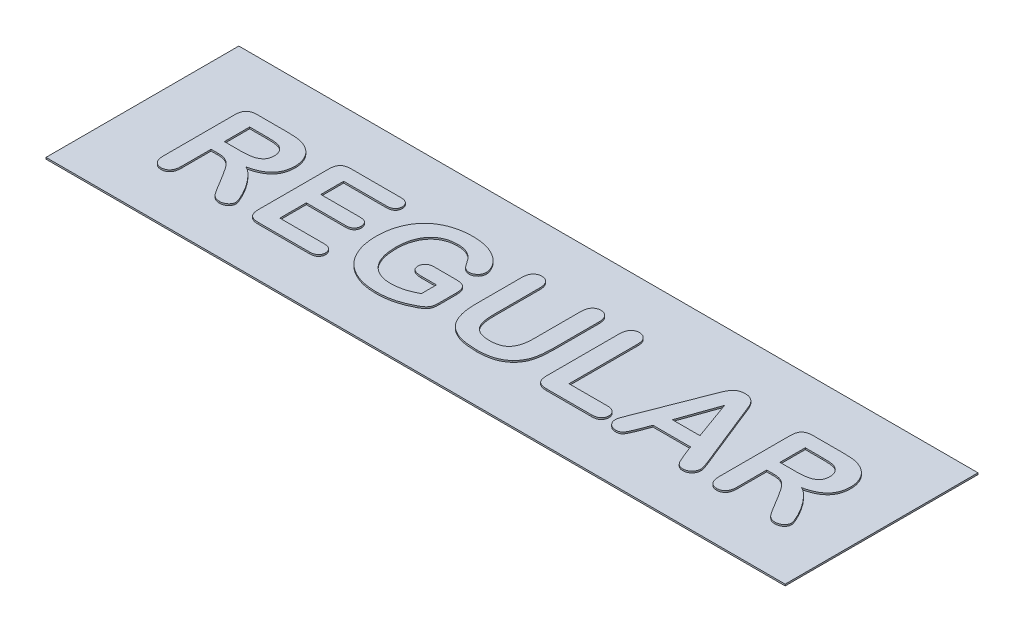
from build123d import *

# Parameters (mm, degrees)
SKETCH1_W             = 46
SKETCH1_H             = 12
BOSS_EXTRUDE2_DEPTH   = 0.1
BOSS_EXTRUDE3_DEPTH   = 0.1
BOSS_EXTRUDE3_2_DEPTH = 0.1
BOSS_EXTRUDE3_3_DEPTH = 0.1
BOSS_EXTRUDE3_4_DEPTH = 0.1
BOSS_EXTRUDE3_5_DEPTH = 0.1
BOSS_EXTRUDE3_6_DEPTH = 0.1
BOSS_EXTRUDE3_7_DEPTH = 0.1


with BuildPart() as part:
    # Sketch1 → Boss-Extrude2 (new body)
    with BuildSketch(Plane(origin=(0, 0, 0), x_dir=(1, 0, 0), z_dir=(0, 1, 0))):
        with Locations((23, 6)):
            Rectangle(SKETCH1_W, SKETCH1_H)
    extrude(amount=-BOSS_EXTRUDE2_DEPTH)


with BuildPart() as body_2:
    # Sketch1<8> → Boss-Extrude3 (new body)
    with BuildSketch(Plane(origin=(0, 0, 0), x_dir=(1, 0, 0), z_dir=(0, 1, 0))):
        with BuildLine():
            Line((4.8, 5.475), (5.20546875, 5.475))
            add(Edge.make_bspline(
                [(6.563671875, 4.4390625), (6.488132931, 4.566049267), (6.379223288, 4.745201379), (6.223959731, 4.957496355), (6.121450414, 5.083819877), (6.02183197, 5.189189861), (5.922440935, 5.275941057), (5.820671752, 5.343078456), (5.717195866, 5.395807363), (5.606013188, 5.432238927), (5.435933712, 5.467970275), (5.299802011, 5.475098601), (5.20546875, 5.475)],
                knots=[0, 0, 0, 0, 0.244142452, 0.345681055, 0.434138568, 0.512613133, 0.584888302, 0.651441801, 0.713464622, 0.776088324, 0.844027858, 1, 1, 1, 1], degree=3))
            Line((6.563671875, 4.4390625), (7.034765625, 3.664453125))
            add(Edge.make_bspline(
                [(7.862109375, 2.925), (7.80077763, 2.924303966), (7.711462553, 2.936055619), (7.6004913, 2.973770215), (7.504731777, 3.028498948), (7.399159332, 3.118185771), (7.309699419, 3.228758574), (7.240720525, 3.333287728), (7.153820201, 3.471973163), (7.082360746, 3.583123174), (7.034765625, 3.664453125)],
                knots=[0, 0, 0, 0, 0.156735873, 0.228882219, 0.298751946, 0.437996262, 0.580828227, 0.661577114, 0.758722562, 1, 1, 1, 1], degree=3))
            add(Edge.make_bspline(
                [(8.428125, 3.390234375), (8.427688268, 3.309405344), (8.390362325, 3.210448226), (8.315575572, 3.111859141), (8.269407939, 3.063725619), (8.215039743, 3.023316341), (8.155179151, 2.9877855), (8.089451505, 2.959584965), (7.991988148, 2.932715505), (7.91497017, 2.923551785), (7.862109375, 2.925)],
                knots=[0, 0, 0, 0, 0.295220797, 0.376756448, 0.457519475, 0.541080536, 0.626619062, 0.714697518, 0.804851451, 1, 1, 1, 1], degree=3))
            add(Edge.make_bspline(
                [(6.840234375, 5.6109375), (6.949950405, 5.555117365), (7.106398278, 5.447812043), (7.300898579, 5.276897241), (7.44272375, 5.125475185), (7.580450643, 4.96389644), (7.713491615, 4.796465363), (7.837563874, 4.623011222), (7.951915159, 4.446222298), (8.057695077, 4.272465909), (8.151831942, 4.104935819), (8.23251678, 3.945508196), (8.301138243, 3.797455583), (8.35561695, 3.665287643), (8.402246218, 3.532712789), (8.425659253, 3.443246141), (8.428125, 3.390234375)],
                knots=[0, 0, 0, 0, 0.131918797, 0.202970264, 0.277760532, 0.354539483, 0.43101514, 0.507400958, 0.583515463, 0.657132417, 0.725886823, 0.789877002, 0.849016927, 0.901145487, 0.943344078, 1, 1, 1, 1], degree=3))
            add(Edge.make_bspline(
                [(8.325, 7.187109375), (8.325355895, 7.08475474), (8.313948751, 6.934506471), (8.275776273, 6.741460278), (8.236790465, 6.607451357), (8.182762332, 6.482536912), (8.120094895, 6.365099851), (8.045217076, 6.255719388), (7.958282005, 6.154807007), (7.858988233, 6.062219311), (7.748880557, 5.975897337), (7.627204263, 5.896226823), (7.492679261, 5.825047399), (7.346699794, 5.760199145), (7.129756286, 5.682932639), (6.959099235, 5.634595403), (6.840234375, 5.6109375)],
                knots=[0, 0, 0, 0, 0.128838583, 0.189022761, 0.247527807, 0.304161196, 0.36005304, 0.414889875, 0.470686436, 0.527396645, 0.585540917, 0.646650323, 0.710236628, 0.776948807, 0.847579249, 1, 1, 1, 1], degree=3))
            add(Edge.make_bspline(
                [(7.40859375, 8.6015625), (7.499085111, 8.563901578), (7.629602741, 8.494443625), (7.787684196, 8.377360482), (7.896578878, 8.277053213), (7.996672685, 8.16800573), (8.0819868, 8.047080907), (8.156484974, 7.919163212), (8.2173836, 7.782717198), (8.264787242, 7.640082538), (8.313399382, 7.442691358), (8.323706597, 7.289360773), (8.325, 7.187109375)],
                knots=[0, 0, 0, 0, 0.164225545, 0.246593832, 0.329086935, 0.412064511, 0.494190426, 0.576621145, 0.659854065, 0.744123517, 0.828291164, 1, 1, 1, 1], degree=3))
            add(Edge.make_bspline(
                [(6.25078125, 8.775), (6.370285572, 8.773587483), (6.543309163, 8.773082212), (6.763880029, 8.75614966), (6.910171704, 8.741246399), (7.046021318, 8.721203113), (7.21348561, 8.680119583), (7.333459015, 8.638125672), (7.40859375, 8.6015625)],
                knots=[0, 0, 0, 0, 0.30393904, 0.439344554, 0.562157432, 0.67773677, 0.788038966, 1, 1, 1, 1], degree=3))
            Line((6.25078125, 8.775), (4.38046875, 8.775))
            add(Edge.make_bspline(
                [(3.675, 8.061328125), (3.675308005, 8.170279478), (3.689199915, 8.326180519), (3.762022187, 8.508006939), (3.837127021, 8.61036927), (3.938266296, 8.68673292), (4.117849906, 8.761504861), (4.272818959, 8.774435976), (4.38046875, 8.775)],
                knots=[0, 0, 0, 0, 0.28251968, 0.39735437, 0.501853918, 0.606158559, 0.720460412, 1, 1, 1, 1], degree=3))
            Line((3.675, 8.061328125), (3.675, 3.63515625))
            add(Edge.make_bspline(
                [(4.23984375, 2.925), (4.158886662, 2.925589465), (4.037699026, 2.94378944), (3.901470704, 3.023932799), (3.817615614, 3.103967843), (3.752582037, 3.207513798), (3.688883057, 3.384039244), (3.67482532, 3.532042676), (3.675, 3.63515625)],
                knots=[0, 0, 0, 0, 0.23764918, 0.345820654, 0.45613364, 0.572351178, 0.698802028, 1, 1, 1, 1], degree=3))
            add(Edge.make_bspline(
                [(4.8, 3.6328125), (4.799883814, 3.527204631), (4.787898379, 3.375043947), (4.718177394, 3.197022183), (4.649341031, 3.096050324), (4.563994624, 3.019648051), (4.431937759, 2.94415627), (4.316812386, 2.924338285), (4.23984375, 2.925)],
                knots=[0, 0, 0, 0, 0.31150778, 0.440094073, 0.55712165, 0.666707926, 0.773500033, 1, 1, 1, 1], degree=3))
            Line((4.8, 3.6328125), (4.8, 5.475))
        make_face()
        with BuildLine():
            Line((4.8, 7.875), (5.86875, 7.875))
            add(Edge.make_bspline(
                [(6.669140625, 7.789453125), (6.628150302, 7.805576607), (6.558954544, 7.825809941), (6.456802901, 7.841739161), (6.363193382, 7.855318454), (6.257168718, 7.864345061), (6.09108398, 7.871401594), (5.960224258, 7.87634057), (5.86875, 7.875)],
                knots=[0, 0, 0, 0, 0.163377821, 0.266296542, 0.383317579, 0.51425336, 0.660794558, 1, 1, 1, 1], degree=3))
            add(Edge.make_bspline(
                [(7.125, 7.096875), (7.126439489, 7.172908836), (7.110825528, 7.284837504), (7.059457829, 7.424166375), (7.006534694, 7.518721496), (6.941003814, 7.60521102), (6.833620245, 7.705002836), (6.73813641, 7.761939914), (6.669140625, 7.789453125)],
                knots=[0, 0, 0, 0, 0.258249544, 0.38020611, 0.503358993, 0.625641018, 0.747872473, 1, 1, 1, 1], degree=3))
            add(Edge.make_bspline(
                [(5.837109375, 6.3), (5.965703401, 6.301076317), (6.150653996, 6.306319733), (6.384966129, 6.337230903), (6.536075341, 6.368125316), (6.672019222, 6.409070051), (6.789539875, 6.466294173), (6.892994353, 6.532518553), (6.977630186, 6.615058013), (7.04561401, 6.712244152), (7.110058, 6.871834148), (7.125233852, 7.005274554), (7.125, 7.096875)],
                knots=[0, 0, 0, 0, 0.223419646, 0.320582623, 0.409966491, 0.491044997, 0.566273496, 0.636246749, 0.703392198, 0.770177044, 0.840710079, 1, 1, 1, 1], degree=3))
            Line((5.837109375, 6.3), (4.8, 6.3))
            Line((4.8, 6.3), (4.8, 7.875))
        make_face(mode=Mode.SUBTRACT)
    extrude(amount=BOSS_EXTRUDE3_DEPTH)


with BuildPart() as body_3:
    # Sketch1<8> → Boss-Extrude3 2 (new body)
    with BuildSketch(Plane(origin=(0, 0, 0), x_dir=(1, 0, 0), z_dir=(0, 1, 0))):
        with BuildLine():
            Line((10.65, 7.875), (13.29609375, 7.875))
            add(Edge.make_bspline(
                [(13.850390625, 8.32734375), (13.850773588, 8.264579899), (13.836245453, 8.170288747), (13.775431727, 8.062738343), (13.714599634, 7.994241991), (13.635241465, 7.939564218), (13.496630735, 7.884342893), (13.37787849, 7.877145344), (13.29609375, 7.875)],
                knots=[0, 0, 0, 0, 0.23312118, 0.342370478, 0.452806013, 0.56896429, 0.695252156, 1, 1, 1, 1], degree=3))
            add(Edge.make_bspline(
                [(13.29609375, 8.775), (13.377594366, 8.772195575), (13.497255442, 8.766744358), (13.634953597, 8.709003244), (13.714721459, 8.654717988), (13.774660484, 8.586402875), (13.836770414, 8.481797204), (13.850296333, 8.38873056), (13.850390625, 8.32734375)],
                knots=[0, 0, 0, 0, 0.306655187, 0.434288731, 0.551174014, 0.662300739, 0.7697085, 1, 1, 1, 1], degree=3))
            Line((13.29609375, 8.775), (10.2140625, 8.775))
            add(Edge.make_bspline(
                [(9.525, 8.0578125), (9.525693912, 8.13416374), (9.531528207, 8.244299349), (9.561998454, 8.381448349), (9.593834136, 8.468198914), (9.634501115, 8.54455926), (9.687234981, 8.609185452), (9.750259263, 8.662305605), (9.823049373, 8.705404862), (9.906657417, 8.736215072), (10.036415053, 8.769710059), (10.141820693, 8.773446574), (10.2140625, 8.775)],
                knots=[0, 0, 0, 0, 0.198923952, 0.285459035, 0.364561105, 0.438695517, 0.509487423, 0.580147896, 0.652133435, 0.728383258, 0.811204159, 1, 1, 1, 1], degree=3))
            Line((9.525, 8.0578125), (9.525, 3.7171875))
            add(Edge.make_bspline(
                [(10.2140625, 3), (10.108332644, 3.000296848), (9.955970111, 3.013587041), (9.779965317, 3.088314308), (9.680603595, 3.164855755), (9.608783114, 3.268838684), (9.536863079, 3.451213022), (9.527305314, 3.608411538), (9.525, 3.7171875)],
                knots=[0, 0, 0, 0, 0.276680916, 0.389999231, 0.493501638, 0.598426673, 0.714696995, 1, 1, 1, 1], degree=3))
            Line((10.2140625, 3), (13.3875, 3))
            add(Edge.make_bspline(
                [(13.9453125, 3.446484375), (13.947522376, 3.384865313), (13.928630468, 3.294255844), (13.869072123, 3.187884105), (13.805811083, 3.120816037), (13.72552466, 3.065558889), (13.586414383, 3.011751537), (13.469028069, 3.000371927), (13.3875, 3)],
                knots=[0, 0, 0, 0, 0.227881193, 0.33651993, 0.449574496, 0.567622836, 0.696013188, 1, 1, 1, 1], degree=3))
            add(Edge.make_bspline(
                [(13.3875, 3.9), (13.468426618, 3.897686895), (13.587164331, 3.890913627), (13.72525912, 3.834126283), (13.805820022, 3.779263489), (13.869397865, 3.711911944), (13.929300088, 3.603061758), (13.946973989, 3.509829457), (13.9453125, 3.446484375)],
                knots=[0, 0, 0, 0, 0.301114702, 0.428957738, 0.546002067, 0.658095095, 0.76706378, 1, 1, 1, 1], degree=3))
            Line((13.3875, 3.9), (10.65, 3.9))
            Line((10.65, 3.9), (10.65, 5.55))
            Line((10.65, 5.55), (13.086328125, 5.55))
            add(Edge.make_bspline(
                [(13.620703125, 6.003515625), (13.621232245, 5.94179952), (13.606167392, 5.849795065), (13.549204022, 5.742392505), (13.491126944, 5.673292262), (13.415319924, 5.616891989), (13.281488685, 5.560003506), (13.165941204, 5.551352304), (13.086328125, 5.55)],
                knots=[0, 0, 0, 0, 0.23345114, 0.343651819, 0.45565437, 0.571599419, 0.697114971, 1, 1, 1, 1], degree=3))
            add(Edge.make_bspline(
                [(13.086328125, 6.45), (13.165001897, 6.447975159), (13.279659965, 6.440553228), (13.413004241, 6.38514946), (13.489440245, 6.330747911), (13.548090685, 6.263077606), (13.607305409, 6.157619891), (13.620623224, 6.064934483), (13.620703125, 6.003515625)],
                knots=[0, 0, 0, 0, 0.301571246, 0.427298253, 0.544300415, 0.654763056, 0.765065983, 1, 1, 1, 1], degree=3))
            Line((13.086328125, 6.45), (10.65, 6.45))
            Line((10.65, 6.45), (10.65, 7.875))
        make_face()
    extrude(amount=BOSS_EXTRUDE3_2_DEPTH)


with BuildPart() as body_4:
    # Sketch1<8> → Boss-Extrude3 3 (new body)
    with BuildSketch(Plane(origin=(0, 0, 0), x_dir=(1, 0, 0), z_dir=(0, 1, 0))):
        with BuildLine():
            Line((20.175, 4.26328125), (20.175, 5.373046875))
            add(Edge.make_bspline(
                [(19.3828125, 6.075), (19.45826278, 6.075128587), (19.567134847, 6.071495909), (19.704917092, 6.051932486), (19.795260748, 6.032774344), (19.877823346, 6.003888033), (19.952073724, 5.960968065), (20.01733925, 5.903395612), (20.074384752, 5.832098879), (20.121353534, 5.744035872), (20.167023522, 5.590647375), (20.173201238, 5.462673428), (20.175, 5.373046875)],
                knots=[0, 0, 0, 0, 0.182635189, 0.262813499, 0.336401339, 0.405747724, 0.473491938, 0.542470401, 0.615074948, 0.693280203, 0.782342712, 1, 1, 1, 1], degree=3))
            Line((19.3828125, 6.075), (18.055078125, 6.075))
            add(Edge.make_bspline(
                [(17.534765625, 5.619140625), (17.532843062, 5.681018627), (17.551390921, 5.772594156), (17.611303754, 5.879762582), (17.672587635, 5.949164247), (17.749706598, 6.005676941), (17.875141934, 6.063691467), (17.982822418, 6.073599632), (18.055078125, 6.075)],
                knots=[0, 0, 0, 0, 0.238017011, 0.352115555, 0.470709416, 0.592556655, 0.718731389, 1, 1, 1, 1], degree=3))
            add(Edge.make_bspline(
                [(18.20625, 5.175), (18.108684038, 5.172744535), (17.971281838, 5.185565873), (17.803336897, 5.226248418), (17.705342096, 5.270464603), (17.628124184, 5.332064251), (17.549001424, 5.442632433), (17.535465292, 5.549358696), (17.534765625, 5.619140625)],
                knots=[0, 0, 0, 0, 0.318178419, 0.448792747, 0.562963014, 0.666395041, 0.768008497, 1, 1, 1, 1], degree=3))
            Line((18.20625, 5.175), (19.125, 5.175))
            Line((19.125, 5.175), (19.125, 4.23515625))
            add(Edge.make_bspline(
                [(17.619140625, 3.825), (17.75236847, 3.825157659), (17.949771281, 3.838341645), (18.207089618, 3.881877302), (18.392264591, 3.92994215), (18.575206997, 3.989127423), (18.822690567, 4.084437619), (19.004414503, 4.172005975), (19.125, 4.23515625)],
                knots=[0, 0, 0, 0, 0.253330495, 0.375477271, 0.495850923, 0.616855766, 0.741037341, 1, 1, 1, 1], degree=3))
            add(Edge.make_bspline(
                [(15.825, 5.954296875), (15.824872026, 5.79305804), (15.836851966, 5.557173672), (15.88835108, 5.255723802), (15.939344045, 5.050396252), (16.006513076, 4.859926164), (16.086875941, 4.683070334), (16.183397939, 4.521378995), (16.294964676, 4.375735254), (16.419799366, 4.246237401), (16.556214945, 4.13283916), (16.704971986, 4.037208132), (16.865776823, 3.959753483), (17.037399697, 3.898632962), (17.287976765, 3.839256248), (17.485006468, 3.82475865), (17.619140625, 3.825)],
                knots=[0, 0, 0, 0, 0.153120873, 0.223461909, 0.29000586, 0.353679431, 0.414896232, 0.474094665, 0.53201133, 0.588649987, 0.644477034, 0.700013997, 0.75606222, 0.813524948, 0.872608323, 1, 1, 1, 1], degree=3))
            add(Edge.make_bspline(
                [(17.5875, 8.025), (17.457003316, 8.023343439), (17.264227348, 8.010216123), (17.019731899, 7.948904705), (16.85150272, 7.886847267), (16.694916953, 7.807790944), (16.549424383, 7.713680706), (16.416233995, 7.602592757), (16.295153529, 7.475573092), (16.187398415, 7.332869485), (16.091252242, 7.175982336), (16.011166838, 7.002496775), (15.943154534, 6.815632571), (15.89110944, 6.615387675), (15.83788072, 6.32859925), (15.826558071, 6.105332829), (15.825, 5.954296875)],
                knots=[0, 0, 0, 0, 0.127641894, 0.187397585, 0.245562006, 0.302359923, 0.358320624, 0.414380012, 0.471299447, 0.529272238, 0.58866412, 0.650597714, 0.715506052, 0.782575708, 0.852370386, 1, 1, 1, 1], degree=3))
            add(Edge.make_bspline(
                [(19.025390625, 7.098046875), (18.961006291, 7.199794557), (18.865627031, 7.340288752), (18.738927852, 7.510260705), (18.655732902, 7.611155537), (18.571617775, 7.700336359), (18.47361538, 7.775791591), (18.364804633, 7.846643867), (18.241590961, 7.908863148), (18.103851982, 7.962946285), (17.885034405, 8.014089943), (17.709423269, 8.025239437), (17.5875, 8.025)],
                knots=[0, 0, 0, 0, 0.199023805, 0.280652239, 0.350356095, 0.415206138, 0.482780362, 0.554253716, 0.629634752, 0.710588548, 0.798302462, 1, 1, 1, 1], degree=3))
            add(Edge.make_bspline(
                [(19.45546875, 6.86953125), (19.372661835, 6.870022882), (19.203875255, 6.911789967), (19.075352347, 7.028824819), (19.025390625, 7.098046875)],
                knots=[0, 0, 0, 0, 0.491718007, 1, 1, 1, 1], degree=3))
            add(Edge.make_bspline(
                [(20.0015625, 7.402734375), (20.000487538, 7.333139841), (19.983190022, 7.227223612), (19.913224634, 7.10409879), (19.843190019, 7.022999001), (19.759481769, 6.955301225), (19.633423203, 6.887570092), (19.526539519, 6.868521148), (19.45546875, 6.86953125)],
                knots=[0, 0, 0, 0, 0.247579886, 0.369503948, 0.496961307, 0.62477804, 0.748468476, 1, 1, 1, 1], degree=3))
            add(Edge.make_bspline(
                [(17.658984375, 8.925), (17.843869845, 8.925286094), (18.114919407, 8.908739044), (18.460826798, 8.84177079), (18.695526981, 8.773894236), (18.910213764, 8.690250771), (19.106381183, 8.598557704), (19.280384607, 8.494471992), (19.432058553, 8.379639497), (19.565430437, 8.260013744), (19.680016917, 8.135160481), (19.780424963, 8.008917806), (19.85906271, 7.877969742), (19.920168163, 7.749851127), (19.981733113, 7.595619358), (19.999480787, 7.477529496), (20.0015625, 7.402734375)],
                knots=[0, 0, 0, 0, 0.181803163, 0.265915446, 0.345871847, 0.421598127, 0.492185602, 0.558495567, 0.620467127, 0.678916479, 0.734345528, 0.786879652, 0.837188969, 0.884071692, 0.92635987, 1, 1, 1, 1], degree=3))
            add(Edge.make_bspline(
                [(14.625, 5.925), (14.625657261, 6.141743374), (14.647657747, 6.462113726), (14.733474, 6.874256087), (14.822258395, 7.162765116), (14.935600498, 7.433881352), (15.072776638, 7.685017944), (15.234608165, 7.914029072), (15.419309155, 8.121757041), (15.628129313, 8.305965993), (15.857876255, 8.469090502), (16.109971444, 8.607073314), (16.382452644, 8.722356692), (16.674417198, 8.813402723), (17.099628673, 8.903393921), (17.432548295, 8.924394115), (17.658984375, 8.925)],
                knots=[0, 0, 0, 0, 0.134576916, 0.198480705, 0.260901207, 0.321640924, 0.380557305, 0.438135163, 0.495313525, 0.552673029, 0.610588798, 0.669834466, 0.730668456, 0.79392747, 0.859354592, 1, 1, 1, 1], degree=3))
            add(Edge.make_bspline(
                [(17.600390625, 2.925), (17.385375313, 2.924468283), (17.068483298, 2.949476143), (16.6605831, 3.034095584), (16.37658487, 3.124735562), (16.109734848, 3.239234576), (15.862529511, 3.378296006), (15.63457066, 3.539082967), (15.428685747, 3.724428432), (15.24380667, 3.9311215), (15.082558437, 4.160381093), (14.944179947, 4.410089458), (14.827941707, 4.67918111), (14.736317812, 4.966809246), (14.649988927, 5.382050087), (14.623689924, 5.705219787), (14.625, 5.925)],
                knots=[0, 0, 0, 0, 0.135046884, 0.199020121, 0.261348905, 0.322032348, 0.381152589, 0.439241891, 0.496944149, 0.554829327, 0.613118939, 0.6726676, 0.733898991, 0.797003829, 0.861988355, 1, 1, 1, 1], degree=3))
            add(Edge.make_bspline(
                [(19.68515625, 3.465234375), (19.51664343, 3.374728892), (19.262075021, 3.255146192), (18.918442926, 3.126016598), (18.667892028, 3.051089302), (18.414552104, 2.99425632), (18.059354878, 2.940622998), (17.785984239, 2.924748479), (17.600390625, 2.925)],
                knots=[0, 0, 0, 0, 0.26347845, 0.386936225, 0.505444447, 0.623475133, 0.744342742, 1, 1, 1, 1], degree=3))
            add(Edge.make_bspline(
                [(20.175, 4.26328125), (20.175875457, 4.196711155), (20.17068948, 4.102097342), (20.153636322, 3.983966813), (20.134756841, 3.910310896), (20.108282369, 3.844208761), (20.073885144, 3.781907737), (20.028965526, 3.723799255), (19.911514515, 3.602301672), (19.787812226, 3.523582178), (19.68515625, 3.465234375)],
                knots=[0, 0, 0, 0, 0.198984665, 0.282919619, 0.356593177, 0.425796275, 0.495353457, 0.568720718, 0.644737465, 1, 1, 1, 1], degree=3))
        make_face()
    extrude(amount=BOSS_EXTRUDE3_3_DEPTH)


with BuildPart() as body_5:
    # Sketch1<8> → Boss-Extrude3 4 (new body)
    with BuildSketch(Plane(origin=(0, 0, 0), x_dir=(1, 0, 0), z_dir=(0, 1, 0))):
        with BuildLine():
            Line((21.375, 8.2125), (21.375, 5.422265625))
            add(Edge.make_bspline(
                [(23.872265625, 2.925), (23.667149894, 2.925274822), (23.369519442, 2.940644926), (22.990607491, 3.000650375), (22.739539423, 3.063940986), (22.509889682, 3.14483694), (22.303980834, 3.249384757), (22.117197356, 3.369615518), (21.95417934, 3.513273621), (21.81208871, 3.676895715), (21.690046749, 3.861374037), (21.591558297, 4.068381145), (21.509446338, 4.295394589), (21.450573551, 4.545358089), (21.388044757, 4.921544766), (21.377041069, 5.218202711), (21.375, 5.422265625)],
                knots=[0, 0, 0, 0, 0.15012156, 0.217605972, 0.280419527, 0.339375197, 0.395368681, 0.449044181, 0.50150868, 0.553785163, 0.607221881, 0.662835377, 0.721156299, 0.783554144, 0.850474362, 1, 1, 1, 1], degree=3))
            add(Edge.make_bspline(
                [(25.569140625, 3.46640625), (25.465671564, 3.372956169), (25.294460295, 3.250618939), (25.042858707, 3.124617981), (24.840036767, 3.049536367), (24.621962303, 2.993476555), (24.299104792, 2.939506787), (24.046137809, 2.924751763), (23.872265625, 2.925)],
                knots=[0, 0, 0, 0, 0.229149941, 0.344101896, 0.462032743, 0.584228347, 0.713958963, 1, 1, 1, 1], degree=3))
            add(Edge.make_bspline(
                [(26.175, 5.409375), (26.173669365, 5.200239989), (26.1635918, 4.899040611), (26.107939118, 4.519371087), (26.054308321, 4.272464635), (25.976347493, 4.046133102), (25.832908034, 3.764364359), (25.682911255, 3.577967591), (25.569140625, 3.46640625)],
                knots=[0, 0, 0, 0, 0.299640476, 0.430200055, 0.548894043, 0.660835349, 0.771867984, 1, 1, 1, 1], degree=3))
            Line((26.175, 5.409375), (26.175, 8.21015625))
            add(Edge.make_bspline(
                [(25.606640625, 8.925), (25.685269353, 8.926907716), (25.801614481, 8.904359027), (25.936948719, 8.82847827), (26.022676526, 8.749147159), (26.09343603, 8.647514674), (26.162290555, 8.467986089), (26.174931968, 8.315909326), (26.175, 8.21015625)],
                knots=[0, 0, 0, 0, 0.227643408, 0.335773029, 0.446498084, 0.56379466, 0.691995246, 1, 1, 1, 1], degree=3))
            add(Edge.make_bspline(
                [(25.05, 8.2078125), (25.051040632, 8.313654242), (25.061422198, 8.466396852), (25.129552114, 8.64552172), (25.196592297, 8.748087617), (25.279540123, 8.828779572), (25.413746012, 8.904014337), (25.528546553, 8.927568008), (25.606640625, 8.925)],
                knots=[0, 0, 0, 0, 0.310606878, 0.439089129, 0.555110916, 0.665556506, 0.773286685, 1, 1, 1, 1], degree=3))
            Line((25.05, 8.2078125), (25.05, 5.3109375))
            add(Edge.make_bspline(
                [(23.780859375, 3.825), (23.888722676, 3.824412304), (24.044675289, 3.835707345), (24.242626474, 3.87297978), (24.372028629, 3.914506788), (24.489594647, 3.965966749), (24.594272918, 4.02908921), (24.686517806, 4.104165428), (24.765614729, 4.191732965), (24.832367209, 4.292075501), (24.891426236, 4.402556495), (24.94010321, 4.525477303), (24.981299139, 4.659391342), (25.012671016, 4.8056507), (25.04280521, 5.02355636), (25.049315366, 5.194014362), (25.05, 5.3109375)],
                knots=[0, 0, 0, 0, 0.143077495, 0.207040083, 0.26689435, 0.323068959, 0.377046866, 0.428633268, 0.48039397, 0.533030288, 0.588236942, 0.64639392, 0.708227811, 0.774030232, 0.844719661, 1, 1, 1, 1], degree=3))
            add(Edge.make_bspline(
                [(22.5, 5.335546875), (22.50083803, 5.18533824), (22.510266303, 4.968261353), (22.556876516, 4.694972814), (22.603832467, 4.51814559), (22.669615393, 4.360183769), (22.757061586, 4.221068589), (22.866691476, 4.101076741), (22.974732824, 4.017182154), (23.072015779, 3.961671557), (23.152942677, 3.925206374), (23.240433188, 3.893190733), (23.335754939, 3.869691675), (23.436901377, 3.849095178), (23.585799831, 3.830766303), (23.701341541, 3.823471471), (23.780859375, 3.825)],
                knots=[0, 0, 0, 0, 0.196281644, 0.282723689, 0.361535728, 0.434661215, 0.505262341, 0.574936417, 0.645831639, 0.682836298, 0.720948918, 0.761600816, 0.804275299, 0.848982672, 0.896298707, 1, 1, 1, 1], degree=3))
            Line((22.5, 5.335546875), (22.5, 8.2078125))
            add(Edge.make_bspline(
                [(21.931640625, 8.925), (22.010968136, 8.924009023), (22.130705574, 8.906307547), (22.266481625, 8.827304266), (22.351402146, 8.746995156), (22.419157038, 8.643662997), (22.486689019, 8.464659033), (22.500147823, 8.313201392), (22.5, 8.2078125)],
                knots=[0, 0, 0, 0, 0.231224273, 0.33960643, 0.449957261, 0.566585036, 0.694003857, 1, 1, 1, 1], degree=3))
            add(Edge.make_bspline(
                [(21.375, 8.2125), (21.374183845, 8.317311155), (21.388915982, 8.467555862), (21.455464046, 8.645876173), (21.524022493, 8.748234418), (21.607783257, 8.828066351), (21.74035146, 8.904347361), (21.854541427, 8.926916633), (21.931640625, 8.925)],
                knots=[0, 0, 0, 0, 0.30819299, 0.437462835, 0.554830668, 0.666784575, 0.774181686, 1, 1, 1, 1], degree=3))
        make_face()
    extrude(amount=BOSS_EXTRUDE3_4_DEPTH)


with BuildPart() as body_6:
    # Sketch1<8> → Boss-Extrude3 5 (new body)
    with BuildSketch(Plane(origin=(0, 0, 0), x_dir=(1, 0, 0), z_dir=(0, 1, 0))):
        with BuildLine():
            Line((28.575, 3.975), (28.575, 8.21015625))
            add(Edge.make_bspline(
                [(28.006640625, 8.925), (28.085269574, 8.926907759), (28.201614069, 8.904358946), (28.33694931, 8.828478386), (28.422674192, 8.749146701), (28.49344568, 8.647516567), (28.562229681, 8.467967013), (28.575271577, 8.315961462), (28.575, 8.21015625)],
                knots=[0, 0, 0, 0, 0.227638752, 0.335766161, 0.446488951, 0.563783129, 0.691981092, 1, 1, 1, 1], degree=3))
            add(Edge.make_bspline(
                [(27.45, 8.21015625), (27.449887175, 8.315085934), (27.462968191, 8.466022479), (27.53115649, 8.643907388), (27.598523622, 8.747083857), (27.683205482, 8.826559912), (27.814422405, 8.905631513), (27.930382614, 8.923897207), (28.006640625, 8.925)],
                knots=[0, 0, 0, 0, 0.308898325, 0.436927057, 0.555088936, 0.666891306, 0.77472238, 1, 1, 1, 1], degree=3))
            Line((27.45, 8.21015625), (27.45, 3.723046875))
            add(Edge.make_bspline(
                [(28.1390625, 3), (28.032830556, 2.998816169), (27.881341204, 3.015415176), (27.704502545, 3.089242067), (27.605995081, 3.167303123), (27.533409327, 3.271355196), (27.462128334, 3.455359003), (27.452162409, 3.613381022), (27.45, 3.723046875)],
                knots=[0, 0, 0, 0, 0.275852089, 0.38874046, 0.492479691, 0.597006627, 0.713774744, 1, 1, 1, 1], degree=3))
            Line((28.1390625, 3), (30.95625, 3))
            add(Edge.make_bspline(
                [(31.545703125, 3.483984375), (31.545855676, 3.417489368), (31.529394392, 3.317105597), (31.462780275, 3.202677582), (31.395660793, 3.129996984), (31.31132429, 3.069974606), (31.164709166, 3.013413186), (31.042069742, 2.998798888), (30.95625, 3)],
                knots=[0, 0, 0, 0, 0.232558164, 0.344107656, 0.456771722, 0.574921473, 0.701248759, 1, 1, 1, 1], degree=3))
            add(Edge.make_bspline(
                [(30.95625, 3.975), (31.041335929, 3.976327288), (31.163772025, 3.961289883), (31.309805365, 3.901280343), (31.394246731, 3.837855322), (31.462228121, 3.763604043), (31.529084209, 3.64925134), (31.545549899, 3.54968334), (31.545703125, 3.483984375)],
                knots=[0, 0, 0, 0, 0.295639848, 0.422720727, 0.544076142, 0.659398281, 0.770687605, 1, 1, 1, 1], degree=3))
            Line((30.95625, 3.975), (28.575, 3.975))
        make_face()
    extrude(amount=BOSS_EXTRUDE3_5_DEPTH)


with BuildPart() as body_7:
    # Sketch1<8> → Boss-Extrude3 6 (new body)
    with BuildSketch(Plane(origin=(0, 0, 0), x_dir=(1, 0, 0), z_dir=(0, 1, 0))):
        with BuildLine():
            Line((35.759765625, 4.35), (36.033984375, 3.650390625))
            add(Edge.make_bspline(
                [(36.7078125, 2.925), (36.628054483, 2.924534303), (36.50885076, 2.942847138), (36.381029868, 3.0253801), (36.316362918, 3.088270129), (36.27186133, 3.151059658), (36.23685293, 3.208727311), (36.200670445, 3.276897167), (36.131035522, 3.424453783), (36.078913273, 3.551699027), (36.033984375, 3.650390625)],
                knots=[0, 0, 0, 0, 0.226523959, 0.325260389, 0.423905127, 0.478174604, 0.541284069, 0.613521917, 0.695079761, 1, 1, 1, 1], degree=3))
            add(Edge.make_bspline(
                [(37.275, 3.462890625), (37.274190565, 3.396877377), (37.254319042, 3.294748038), (37.181747633, 3.175314243), (37.11055464, 3.089953733), (37.02476477, 3.016855864), (36.893283522, 2.945206243), (36.782157249, 2.924789554), (36.7078125, 2.925)],
                knots=[0, 0, 0, 0, 0.230434861, 0.351645232, 0.48285161, 0.615972695, 0.741252134, 1, 1, 1, 1], degree=3))
            add(Edge.make_bspline(
                [(37.09921875, 4.08515625), (37.124776463, 4.018736747), (37.165634712, 3.924455135), (37.204531581, 3.799567532), (37.232228327, 3.718809252), (37.249870835, 3.64398134), (37.26850247, 3.560184261), (37.275349271, 3.500272128), (37.275, 3.462890625)],
                knots=[0, 0, 0, 0, 0.328860058, 0.473132764, 0.603729707, 0.722690735, 0.827730125, 1, 1, 1, 1], degree=3))
            Line((37.09921875, 4.08515625), (35.59921875, 7.828125))
            add(Edge.make_bspline(
                [(34.5890625, 8.925), (34.663750549, 8.924957285), (34.77242331, 8.915369138), (34.907070274, 8.875476089), (34.993334133, 8.833305686), (35.071106866, 8.783572308), (35.141877291, 8.727829673), (35.203436077, 8.663396777), (35.27474738, 8.568895571), (35.351468614, 8.440827194), (35.415648827, 8.302611513), (35.462202134, 8.180975399), (35.524008683, 8.032786929), (35.566509948, 7.91222476), (35.59921875, 7.828125)],
                knots=[0, 0, 0, 0, 0.138639711, 0.200750044, 0.259404762, 0.316084189, 0.371754405, 0.426069168, 0.480845866, 0.591060889, 0.702236187, 0.76304832, 0.83260591, 1, 1, 1, 1], degree=3))
            add(Edge.make_bspline(
                [(33.587109375, 7.82109375), (33.609163512, 7.880853784), (33.647119375, 7.973431317), (33.695590469, 8.103711731), (33.73710848, 8.210453851), (33.779377985, 8.317352418), (33.826963333, 8.416388985), (33.872879752, 8.50731055), (33.922729785, 8.588270259), (33.977037012, 8.661372291), (34.0392712, 8.725939155), (34.109801143, 8.782593424), (34.187019353, 8.833815961), (34.274051021, 8.874867784), (34.407470733, 8.915695628), (34.515234417, 8.924784213), (34.5890625, 8.925)],
                knots=[0, 0, 0, 0, 0.118106657, 0.185506927, 0.257743184, 0.330514961, 0.398562152, 0.461414498, 0.51930873, 0.574649818, 0.629976682, 0.68507071, 0.742129655, 0.80142528, 0.86282925, 1, 1, 1, 1], degree=3))
            Line((33.587109375, 7.82109375), (32.11875, 4.053515625))
            add(Edge.make_bspline(
                [(31.95, 3.455859375), (31.949445436, 3.539002614), (31.968339551, 3.645837155), (32.013642353, 3.774367034), (32.055646457, 3.892454769), (32.091283229, 3.986983225), (32.11875, 4.053515625)],
                knots=[0, 0, 0, 0, 0.398094416, 0.514956818, 0.65439096, 1, 1, 1, 1], degree=3))
            add(Edge.make_bspline(
                [(32.50546875, 2.925), (32.434945118, 2.924857317), (32.328707095, 2.945838866), (32.201924598, 3.014824073), (32.115515128, 3.084311695), (32.042677099, 3.166507119), (31.972306631, 3.287215377), (31.949203931, 3.388423149), (31.95, 3.455859375)],
                knots=[0, 0, 0, 0, 0.249579023, 0.375279532, 0.508208482, 0.640617668, 0.762157854, 1, 1, 1, 1], degree=3))
            add(Edge.make_bspline(
                [(33.15234375, 3.63515625), (33.106952571, 3.517124466), (33.041418148, 3.356149255), (32.944640181, 3.17032963), (32.884520273, 3.073566611), (32.814399206, 3.002271339), (32.690122687, 2.937513503), (32.580468838, 2.92569131), (32.50546875, 2.925)],
                knots=[0, 0, 0, 0, 0.364088731, 0.498799646, 0.602580848, 0.690781092, 0.782792901, 1, 1, 1, 1], degree=3))
            Line((33.15234375, 3.63515625), (33.4265625, 4.35))
            Line((33.4265625, 4.35), (35.759765625, 4.35))
        make_face()
        Polygon((35.446875, 5.25), (33.73125, 5.25), (34.580859375, 7.65), align=None, mode=Mode.SUBTRACT)
    extrude(amount=BOSS_EXTRUDE3_6_DEPTH)


with BuildPart() as body_8:
    # Sketch1<8> → Boss-Extrude3 7 (new body)
    with BuildSketch(Plane(origin=(0, 0, 0), x_dir=(1, 0, 0), z_dir=(0, 1, 0))):
        with BuildLine():
            Line((39.375, 5.475), (39.78046875, 5.475))
            add(Edge.make_bspline(
                [(41.138671875, 4.4390625), (41.063132931, 4.566049267), (40.954223288, 4.745201379), (40.798959731, 4.957496355), (40.696450414, 5.083819877), (40.59683197, 5.189189861), (40.497440935, 5.275941057), (40.395671752, 5.343078456), (40.292195866, 5.395807363), (40.181013188, 5.432238927), (40.010933712, 5.467970275), (39.874802011, 5.475098601), (39.78046875, 5.475)],
                knots=[0, 0, 0, 0, 0.244142452, 0.345681055, 0.434138568, 0.512613133, 0.584888302, 0.651441801, 0.713464622, 0.776088324, 0.844027858, 1, 1, 1, 1], degree=3))
            Line((41.138671875, 4.4390625), (41.609765625, 3.664453125))
            add(Edge.make_bspline(
                [(42.437109375, 2.925), (42.37577763, 2.924303966), (42.286462553, 2.936055619), (42.1754913, 2.973770215), (42.079731777, 3.028498948), (41.974159332, 3.118185771), (41.884699419, 3.228758574), (41.815720525, 3.333287728), (41.728820201, 3.471973163), (41.657360746, 3.583123174), (41.609765625, 3.664453125)],
                knots=[0, 0, 0, 0, 0.156735873, 0.228882219, 0.298751946, 0.437996262, 0.580828227, 0.661577114, 0.758722562, 1, 1, 1, 1], degree=3))
            add(Edge.make_bspline(
                [(43.003125, 3.390234375), (43.002688268, 3.309405344), (42.965362325, 3.210448226), (42.890575572, 3.111859141), (42.844407939, 3.063725619), (42.790039743, 3.023316341), (42.730179151, 2.9877855), (42.664451505, 2.959584965), (42.566988148, 2.932715505), (42.48997017, 2.923551785), (42.437109375, 2.925)],
                knots=[0, 0, 0, 0, 0.295220797, 0.376756448, 0.457519475, 0.541080536, 0.626619062, 0.714697518, 0.804851451, 1, 1, 1, 1], degree=3))
            add(Edge.make_bspline(
                [(41.415234375, 5.6109375), (41.524950405, 5.555117365), (41.681398278, 5.447812043), (41.875898579, 5.276897241), (42.01772375, 5.125475185), (42.155450643, 4.96389644), (42.288491615, 4.796465363), (42.412563874, 4.623011222), (42.526915159, 4.446222298), (42.632695077, 4.272465909), (42.726831942, 4.104935819), (42.80751678, 3.945508196), (42.876138243, 3.797455583), (42.93061695, 3.665287643), (42.977246218, 3.532712789), (43.000659253, 3.443246141), (43.003125, 3.390234375)],
                knots=[0, 0, 0, 0, 0.131918797, 0.202970264, 0.277760532, 0.354539483, 0.43101514, 0.507400958, 0.583515463, 0.657132417, 0.725886823, 0.789877002, 0.849016927, 0.901145487, 0.943344078, 1, 1, 1, 1], degree=3))
            add(Edge.make_bspline(
                [(42.9, 7.187109375), (42.900355895, 7.08475474), (42.888948751, 6.934506471), (42.850776273, 6.741460278), (42.811790465, 6.607451357), (42.757762332, 6.482536912), (42.695094895, 6.365099851), (42.620217076, 6.255719388), (42.533282005, 6.154807007), (42.433988233, 6.062219311), (42.323880557, 5.975897337), (42.202204263, 5.896226823), (42.067679261, 5.825047399), (41.921699794, 5.760199145), (41.704756286, 5.682932639), (41.534099235, 5.634595403), (41.415234375, 5.6109375)],
                knots=[0, 0, 0, 0, 0.128838583, 0.189022761, 0.247527807, 0.304161196, 0.36005304, 0.414889875, 0.470686436, 0.527396645, 0.585540917, 0.646650323, 0.710236628, 0.776948807, 0.847579249, 1, 1, 1, 1], degree=3))
            add(Edge.make_bspline(
                [(41.98359375, 8.6015625), (42.074085111, 8.563901578), (42.204602741, 8.494443625), (42.362684196, 8.377360482), (42.471578878, 8.277053213), (42.571672685, 8.16800573), (42.6569868, 8.047080907), (42.731484974, 7.919163212), (42.7923836, 7.782717198), (42.839787242, 7.640082538), (42.888399382, 7.442691358), (42.898706597, 7.289360773), (42.9, 7.187109375)],
                knots=[0, 0, 0, 0, 0.164225545, 0.246593832, 0.329086935, 0.412064511, 0.494190426, 0.576621145, 0.659854065, 0.744123517, 0.828291164, 1, 1, 1, 1], degree=3))
            add(Edge.make_bspline(
                [(40.82578125, 8.775), (40.945285572, 8.773587483), (41.118309163, 8.773082212), (41.338880029, 8.75614966), (41.485171704, 8.741246399), (41.621021318, 8.721203113), (41.78848561, 8.680119583), (41.908459015, 8.638125672), (41.98359375, 8.6015625)],
                knots=[0, 0, 0, 0, 0.30393904, 0.439344554, 0.562157432, 0.67773677, 0.788038966, 1, 1, 1, 1], degree=3))
            Line((40.82578125, 8.775), (38.95546875, 8.775))
            add(Edge.make_bspline(
                [(38.25, 8.061328125), (38.250308005, 8.170279478), (38.264199915, 8.326180519), (38.337022187, 8.508006939), (38.412127021, 8.61036927), (38.513266296, 8.68673292), (38.692849906, 8.761504861), (38.847818959, 8.774435976), (38.95546875, 8.775)],
                knots=[0, 0, 0, 0, 0.28251968, 0.39735437, 0.501853918, 0.606158559, 0.720460412, 1, 1, 1, 1], degree=3))
            Line((38.25, 8.061328125), (38.25, 3.63515625))
            add(Edge.make_bspline(
                [(38.81484375, 2.925), (38.733886662, 2.925589465), (38.612699026, 2.94378944), (38.476470704, 3.023932799), (38.392615614, 3.103967843), (38.327582037, 3.207513798), (38.263883057, 3.384039244), (38.24982532, 3.532042676), (38.25, 3.63515625)],
                knots=[0, 0, 0, 0, 0.23764918, 0.345820654, 0.45613364, 0.572351178, 0.698802028, 1, 1, 1, 1], degree=3))
            add(Edge.make_bspline(
                [(39.375, 3.6328125), (39.374883814, 3.527204631), (39.362898379, 3.375043947), (39.293177394, 3.197022183), (39.224341031, 3.096050324), (39.138994624, 3.019648051), (39.006937759, 2.94415627), (38.891812386, 2.924338285), (38.81484375, 2.925)],
                knots=[0, 0, 0, 0, 0.31150778, 0.440094073, 0.55712165, 0.666707926, 0.773500033, 1, 1, 1, 1], degree=3))
            Line((39.375, 3.6328125), (39.375, 5.475))
        make_face()
        with BuildLine():
            Line((39.375, 7.875), (40.44375, 7.875))
            add(Edge.make_bspline(
                [(41.244140625, 7.789453125), (41.203150302, 7.805576607), (41.133954544, 7.825809941), (41.031802901, 7.841739161), (40.938193382, 7.855318454), (40.832168718, 7.864345061), (40.66608398, 7.871401594), (40.535224258, 7.87634057), (40.44375, 7.875)],
                knots=[0, 0, 0, 0, 0.163377821, 0.266296542, 0.383317579, 0.51425336, 0.660794558, 1, 1, 1, 1], degree=3))
            add(Edge.make_bspline(
                [(41.7, 7.096875), (41.701439489, 7.172908836), (41.685825528, 7.284837504), (41.634457829, 7.424166375), (41.581534694, 7.518721496), (41.516003814, 7.60521102), (41.408620245, 7.705002836), (41.31313641, 7.761939914), (41.244140625, 7.789453125)],
                knots=[0, 0, 0, 0, 0.258249544, 0.38020611, 0.503358993, 0.625641018, 0.747872473, 1, 1, 1, 1], degree=3))
            add(Edge.make_bspline(
                [(40.412109375, 6.3), (40.540703401, 6.301076317), (40.725653996, 6.306319733), (40.959966129, 6.337230903), (41.111075341, 6.368125316), (41.247019222, 6.409070051), (41.364539875, 6.466294173), (41.467994353, 6.532518553), (41.552630186, 6.615058013), (41.62061401, 6.712244152), (41.685058, 6.871834148), (41.700233852, 7.005274554), (41.7, 7.096875)],
                knots=[0, 0, 0, 0, 0.223419646, 0.320582623, 0.409966491, 0.491044997, 0.566273496, 0.636246749, 0.703392198, 0.770177044, 0.840710079, 1, 1, 1, 1], degree=3))
            Line((40.412109375, 6.3), (39.375, 6.3))
            Line((39.375, 6.3), (39.375, 7.875))
        make_face(mode=Mode.SUBTRACT)
    extrude(amount=BOSS_EXTRUDE3_7_DEPTH)


solid = Compound([part.part, body_2.part, body_3.part, body_4.part, body_5.part, body_6.part, body_7.part, body_8.part])
